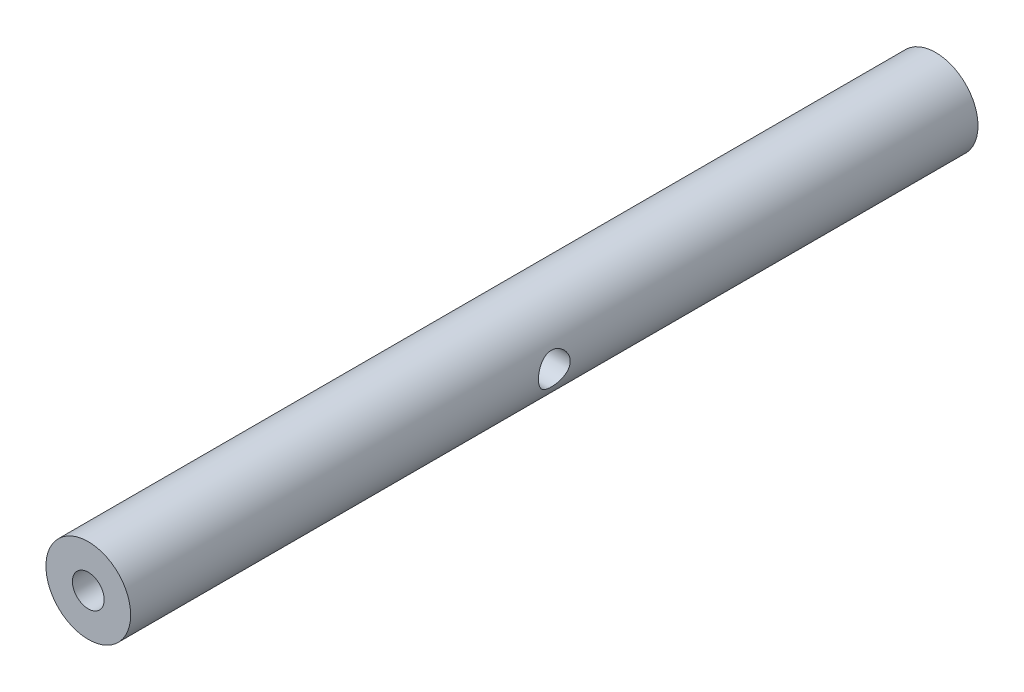
from build123d import *

# Parameters (mm, degrees)
ESBO_O1_R                         = 4
ESBO_O1_R_2                       = 1.5
RESSALTO_EXTRUS_O2_DEPTH          = 80
CORTE_EXTRUS_O1_REACH             = 82.2
ESBO_O2_R                         = 1.5
CORTE_EXTRUS_O1_DIRECTION_2_REACH = 82.2


with BuildPart() as part:
    # Esboço1 → Ressalto-extrusão2 (new body)
    with BuildSketch(Plane.XY):
        Circle(ESBO_O1_R)
        Circle(ESBO_O1_R_2, mode=Mode.SUBTRACT)
    extrude(amount=RESSALTO_EXTRUS_O2_DEPTH)

    # Esboço2 → Corte-extrusão1 (cut, up to next)
    with BuildSketch(Plane(origin=(0, 0, 0), x_dir=(0, 0, -1), z_dir=(1, 0, 0)), mode=Mode.PRIVATE) as corte_extrus_o1_sk1:
        with Locations(Location((-40, 0, 0), (0, 0, 180))):
            Circle(ESBO_O2_R)
    corte_extrus_o1_tool1 = extrude(corte_extrus_o1_sk1.sketch, amount=-CORTE_EXTRUS_O1_REACH, mode=Mode.PRIVATE) & part.part
    add(corte_extrus_o1_tool1.solids().sort_by_distance((0, 0, 40))[0], mode=Mode.SUBTRACT)

    # Esboço2 → Corte-extrusão1 direction 2 (cut, up to next)
    with BuildSketch(Plane(origin=(0, 0, 0), x_dir=(0, 0, -1), z_dir=(1, 0, 0)), mode=Mode.PRIVATE) as corte_extrus_o1_direction_2_sk1:
        with Locations(Location((-40, 0, 0), (0, 0, 180))):
            Circle(ESBO_O2_R)
    corte_extrus_o1_direction_2_tool1 = extrude(corte_extrus_o1_direction_2_sk1.sketch, amount=CORTE_EXTRUS_O1_DIRECTION_2_REACH, mode=Mode.PRIVATE) & part.part
    add(corte_extrus_o1_direction_2_tool1.solids().sort_by_distance((0, 0, 40))[0], mode=Mode.SUBTRACT)


solid = part.part
